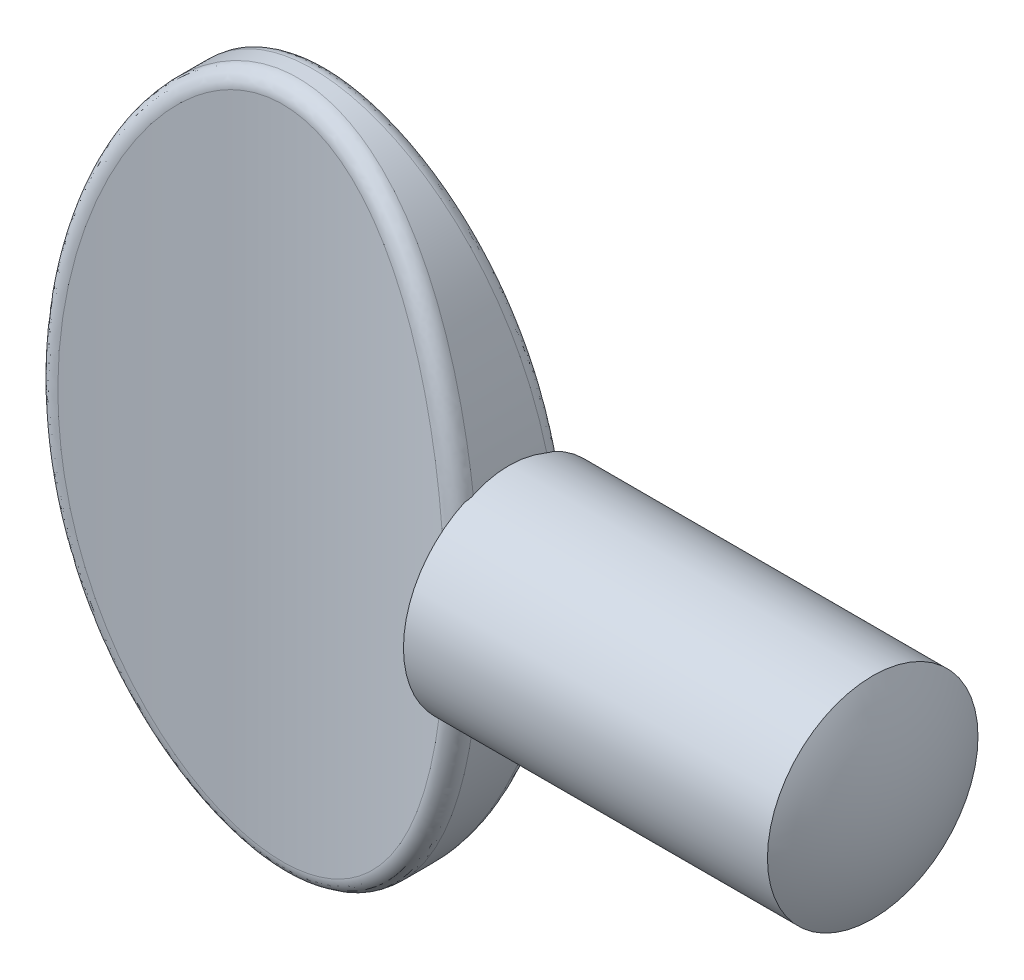
from build123d import *

# Parameters (mm, degrees)
SKETCH1_RX              = 5.715
SKETCH1_RY              = 3.556
EXTRUDE1_DEPTH          = 1.016
CUT_EXTRUDE1_DEPTH      = 7.8072473878947575
CUT_EXTRUDE1_DEPTH_BACK = 7.8072473878947575
SKETCH2_OUTSIDE_W       = 11.834000000000001
SKETCH2_OUTSIDE_H       = 6.754
FILLET3_R               = 0.254


with BuildPart() as part:
    # Sketch1 → Extrude1 (new, symmetric)
    with BuildSketch(Plane.XY):
        with Locations(Location((0, 0), (0, 0, -90))):
            Ellipse(SKETCH1_RX, SKETCH1_RY)
    extrude(amount=EXTRUDE1_DEPTH, both=True)

    # Sketch2 outside → Cut-Extrude1 (cut, two sides: drawn at the far end of the back side and taken through both)
    with BuildSketch(Plane(origin=(0, 0, 0), x_dir=(1, 0, 0), z_dir=(0, 1, 0)).offset(-CUT_EXTRUDE1_DEPTH_BACK)):
        Rectangle(SKETCH2_OUTSIDE_W, SKETCH2_OUTSIDE_H)
        with BuildLine():
            Line((-3.556, 1.016), (-3.556, -1.016))
            ThreePointArc((-3.556, -1.016), (6.3e-16, -0.3810000000000002), (3.556, -1.016))
            Line((3.556, -1.016), (3.556, 1.016))
            ThreePointArc((3.556, 1.016), (6.3e-16, 0.3810000000000002), (-3.556, 1.016))
        make_face(mode=Mode.SUBTRACT)
    extrude(amount=CUT_EXTRUDE1_DEPTH + CUT_EXTRUDE1_DEPTH_BACK, mode=Mode.SUBTRACT)

    # Fillet3
    fillet3_edges = [part.edges().sort_by_distance(p)[0] for p in [
        (-2.772297743363364, -3.579097133488567, 0.7620899166368158),
        (6.761380256e-08, 5.714999999994567, -0.38099999999467776),
    ]]
    fillet(fillet3_edges, radius=FILLET3_R)

    # Sketch3 → Revolve1 (revolve)
    with BuildSketch(Plane(origin=(0, 0, 0), x_dir=(1, 0, 0), z_dir=(0, 1, 0))):
        with BuildLine():
            Line((4.741333333333333, 1.7526), (9.444112027706817, 1.7526))
            ThreePointArc((9.444112027706817, 1.7526), (9.788589708770548, 0.9062211731896787), (9.906, 0))
            Line((9.906, 0), (2.577464628985661, 1e-17))
            Line((2.577464628985661, 1e-17), (2.577464628985661, 0.7095513315322604))
            ThreePointArc((2.577464628985661, 0.7095513315322604), (3.1592934071520324, 1.093146291526699), (3.3846611661960426, 1.7526000000000004))
            Line((3.3846611661960426, 1.7526000000000004), (4.741333333333333, 1.7526))
        make_face()
    revolve(axis=Axis((0, 0, 0), (1, 0, 0)))


solid = part.part
